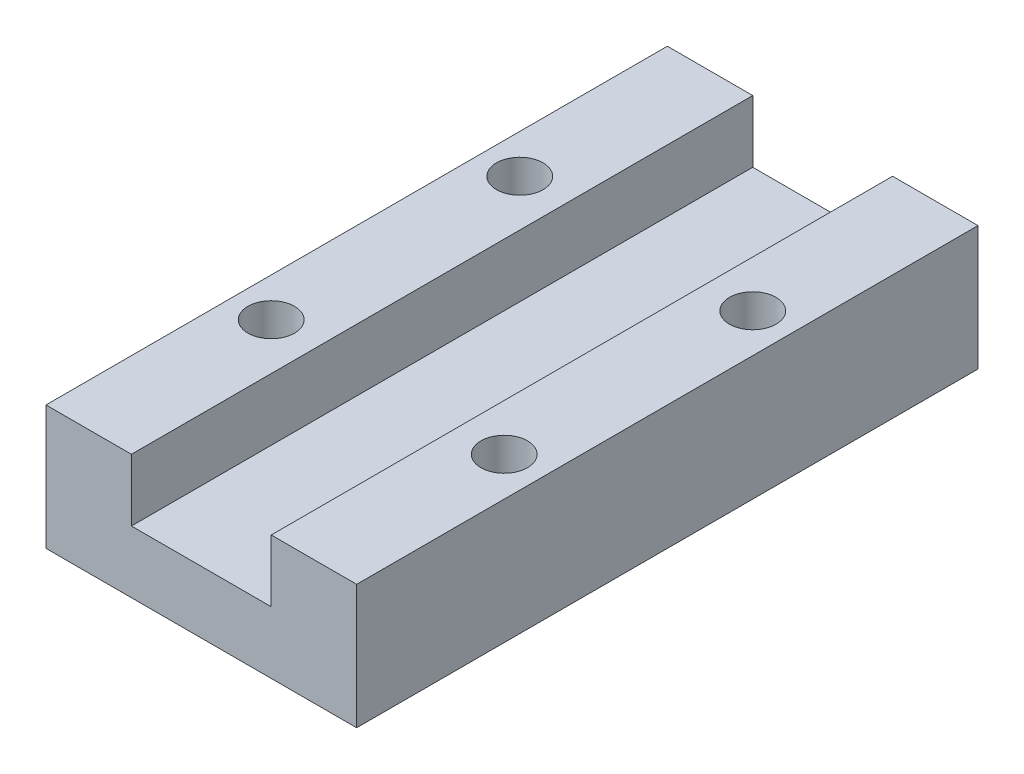
from build123d import *

# Parameters (mm, degrees)
SKETCH_1_W          = 20
SKETCH_1_H          = 40
EXTRUDE_1_DEPTH     = 8
SKETCH_2_R          = 1.5
CUT_EXTRUDE_1_DEPTH = 46.431266766
SKETCH_3_W          = 9
SKETCH_3_H          = 40
CUT_EXTRUDE_2_DEPTH = 4


with BuildPart() as part:
    # 草图1 → 凸台-拉伸1 (new body)
    with BuildSketch(Plane(origin=(0, 0, 0), x_dir=(1, 0, 0), z_dir=(0, 1, 0))):
        with Locations((10, -20)):
            Rectangle(SKETCH_1_W, SKETCH_1_H)
    extrude(amount=EXTRUDE_1_DEPTH)

    # 草图2 → 切除-拉伸1 (cut, through all)
    with BuildSketch(Plane(origin=(0, 8, 0), x_dir=(1, 0, 0), z_dir=(0, 1, 0))):
        with Locations(Location((2.5, -28, 0), (0, 0, 270))):
            Circle(SKETCH_2_R)
        with Locations(Location((17.5, -28, 0), (0, 0, 270))):
            Circle(SKETCH_2_R)
        with Locations(Location((17.5, -12, 0), (0, 0, 270))):
            Circle(SKETCH_2_R)
        with Locations(Location((2.5, -12, 0), (0, 0, 270))):
            Circle(SKETCH_2_R)
    extrude(amount=-CUT_EXTRUDE_1_DEPTH, mode=Mode.SUBTRACT)

    # 草图3 → 切除-拉伸2 (cut)
    with BuildSketch(Plane(origin=(0, 8, 0), x_dir=(1, 0, 0), z_dir=(0, 1, 0))):
        with Locations((10, -20)):
            Rectangle(SKETCH_3_W, SKETCH_3_H)
    extrude(amount=-CUT_EXTRUDE_2_DEPTH, mode=Mode.SUBTRACT)


solid = part.part
